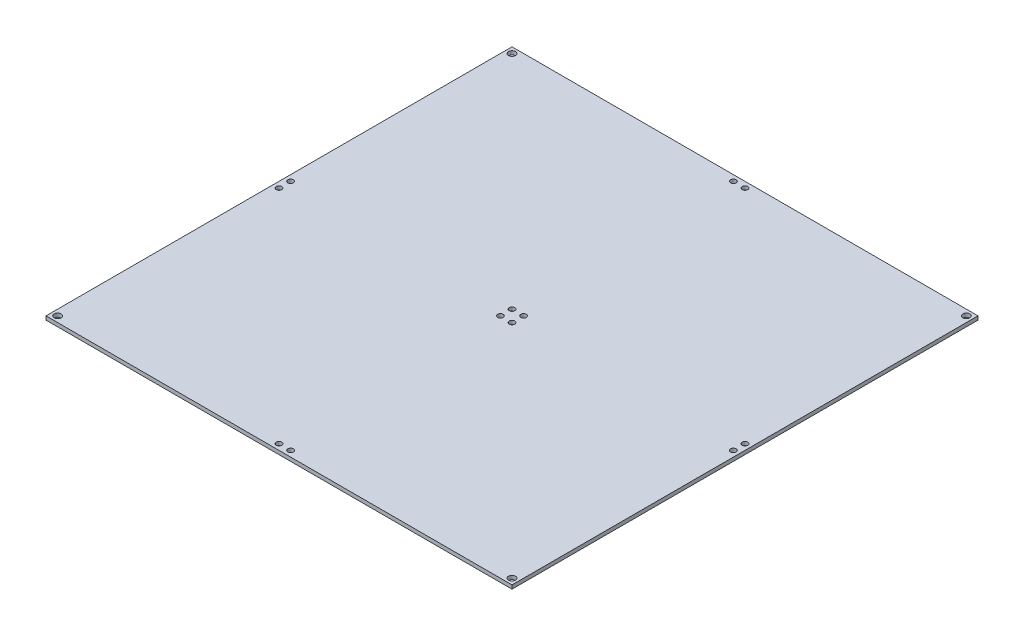
from build123d import *

# Parameters (mm, degrees)
SKETCH1_W                       = 200
SKETCH1_H                       = 200
SKETCH1_R                       = 1.5
BOSS_EXTRUDE2_DEPTH             = 1.6
F_3_32_0_09375_DIAMETER_HOLE1_D = 2.38125


with BuildPart() as part:
    # Sketch1 → Boss-Extrude2 (new body)
    with BuildSketch(Plane(origin=(0, 0, 0), x_dir=(1, 0, 0), z_dir=(0, 1, 0))):
        Rectangle(SKETCH1_W, SKETCH1_H)
        with Locations(Location((-97.5, 97.5, 0), (0, 0, 270))):
            Circle(SKETCH1_R, mode=Mode.SUBTRACT)
        with Locations(Location((97.5, 97.5, 0), (0, 0, 90))):
            Circle(SKETCH1_R, mode=Mode.SUBTRACT)
        with Locations(Location((-97.5, -97.5, 0), (0, 0, 90))):
            Circle(SKETCH1_R, mode=Mode.SUBTRACT)
        with Locations(Location((97.5, -97.5, 0), (0, 0, 270))):
            Circle(SKETCH1_R, mode=Mode.SUBTRACT)
    extrude(amount=BOSS_EXTRUDE2_DEPTH)

    # 3/32 (0.09375) Diameter Hole1 (through all)
    with Locations(Plane(origin=(0, 1.6, 0), x_dir=(1, 0, 0), z_dir=(0, 1, 0))):
        with Locations((2.5, -97.5), (-2.5, -97.5), (2.5, -2.5), (-2.5, -2.5), (-2.5, 2.5), (2.5, 2.5), (-97.5, -2.5), (-97.5, 2.5), (97.5, -2.5), (97.5, 2.5), (2.5, 97.5), (-2.5, 97.5)):
            Hole(F_3_32_0_09375_DIAMETER_HOLE1_D / 2)


solid = part.part
